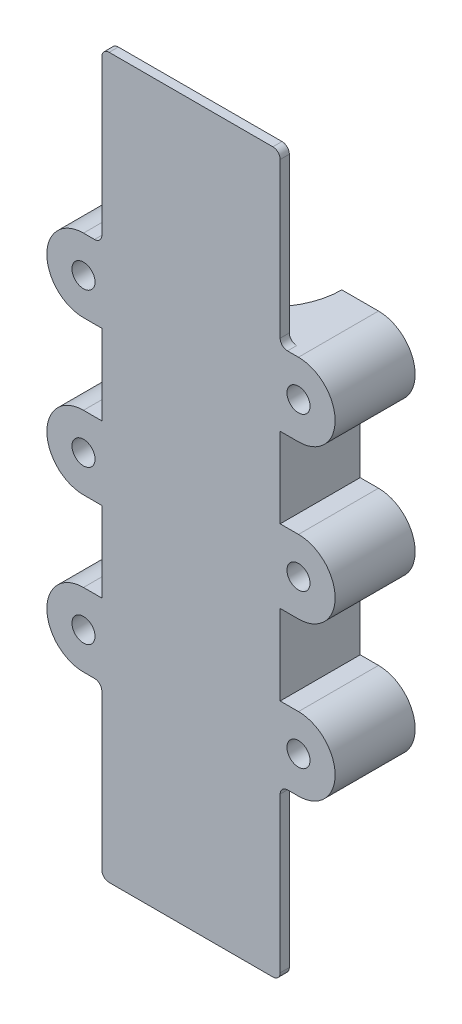
from build123d import *

# Parameters (mm, degrees)
BOSS_EXTRUDE1_DEPTH = 65.8876
BOSS_EXTRUDE2_DEPTH = 29.3624
SKETCH4_R           = 2
BOSS_EXTRUDE3_DEPTH = 13.8684
FILLET1_R           = 1.27


with BuildPart() as part:
    # Sketch1 → Boss-Extrude1 (new body)
    with BuildSketch(Plane(origin=(0, 0, 0), x_dir=(1, 0, 0), z_dir=(0, 1, 0))):
        with BuildLine():
            Line((-12.2809, 0), (-15.4559, 0))
            Line((-15.4559, 0), (-15.4559, -13.3604))
            Line((-15.4559, -13.3604), (-15.4559, -13.8684))
            Line((-15.4559, -13.8684), (0, -13.8684))
            Line((0, -13.8684), (15.4559, -13.8684))
            Line((15.4559, -13.8684), (15.4559, -13.3604))
            Line((15.4559, -13.3604), (15.4559, 0))
            Line((15.4559, 0), (12.2809, 0))
            ThreePointArc((12.2809, 0), (0, -12.2809), (-12.2809, 0))
        make_face()
    extrude(amount=BOSS_EXTRUDE1_DEPTH)

    # Sketch2 → Boss-Extrude2 (add)
    with BuildSketch(Plane(origin=(0, 65.8876, 0), x_dir=(1, 0, 0), z_dir=(0, 1, 0))):
        Polygon((-12.2809, -12.2809), (0, -12.2809), (12.2809, -12.2809), (15.4559, -12.2809), (15.4559, -13.3604), (15.4559, -13.8684), (-15.4559, -13.8684), (-15.4559, -13.3604), (-15.4559, -12.2809), align=None)
    boss_extrude2 = extrude(amount=BOSS_EXTRUDE2_DEPTH)

    # Mirror1: Boss-Extrude2 across plane
    add(boss_extrude2.mirror(Plane.ZX.offset(32.9438)))

    # Sketch4 → Boss-Extrude3 (add, through all)
    # profile 1 of 6: a face of its own
    with BuildSketch(Plane(origin=(0, 0, 0), x_dir=(-1, 0, 0), z_dir=(0, 0, -1))):
        with BuildLine():
            Line((-15.4559, 39.2938), (-15.4559, 26.5938))
            Line((-15.4559, 26.5938), (-18.6309, 26.5938))
            ThreePointArc((-18.6309, 26.5938), (-24.9809, 32.9438), (-18.6309, 39.2938))
            Line((-18.6309, 39.2938), (-15.4559, 39.2938))
        make_face()
        with Locations((-18.6309, 32.9438)):
            Circle(SKETCH4_R, mode=Mode.SUBTRACT)
    # profile 2 of 6: a face of its own
    with BuildSketch(Plane(origin=(0, 0, 0), x_dir=(-1, 0, 0), z_dir=(0, 0, -1))):
        with BuildLine():
            Line((-15.4559, 12.7), (-18.6309, 12.7))
            ThreePointArc((-18.6309, 12.7), (-24.9809, 6.35), (-18.6309, 0))
            Line((-18.6309, 0), (-15.4559, 0))
            Line((-15.4559, 0), (-15.4559, 12.7))
        make_face()
        with Locations(Location((-18.6309, 6.35, 0), (0, 0, 180))):
            Circle(SKETCH4_R, mode=Mode.SUBTRACT)
    # profile 3 of 6: a face of its own
    with BuildSketch(Plane(origin=(0, 0, 0), x_dir=(-1, 0, 0), z_dir=(0, 0, -1))):
        with BuildLine():
            Line((-18.6309, 65.8876), (-15.4559, 65.8876))
            Line((-15.4559, 65.8876), (-15.4559, 53.1876))
            Line((-15.4559, 53.1876), (-18.6309, 53.1876))
            ThreePointArc((-18.6309, 53.1876), (-24.9809, 59.5376), (-18.6309, 65.8876))
        make_face()
        with Locations((-18.6309, 59.5376)):
            Circle(SKETCH4_R, mode=Mode.SUBTRACT)
    # profile 4 of 6: a face of its own
    with BuildSketch(Plane(origin=(0, 0, 0), x_dir=(-1, 0, 0), z_dir=(0, 0, -1))):
        with BuildLine():
            Line((18.6309, 0), (15.4559, 0))
            Line((15.4559, 0), (15.4559, 12.7))
            Line((15.4559, 12.7), (18.6309, 12.7))
            ThreePointArc((18.6309, 12.7), (24.9809, 6.35), (18.6309, 0))
        make_face()
        with Locations((18.6309, 6.35)):
            Circle(SKETCH4_R, mode=Mode.SUBTRACT)
    # profile 5 of 6: a face of its own
    with BuildSketch(Plane(origin=(0, 0, 0), x_dir=(-1, 0, 0), z_dir=(0, 0, -1))):
        with BuildLine():
            Line((15.4559, 53.1876), (18.6309, 53.1876))
            ThreePointArc((18.6309, 53.1876), (24.9809, 59.5376), (18.6309, 65.8876))
            Line((18.6309, 65.8876), (15.4559, 65.8876))
            Line((15.4559, 65.8876), (15.4559, 53.1876))
        make_face()
        with Locations(Location((18.6309, 59.5376, 0), (0, 0, 180))):
            Circle(SKETCH4_R, mode=Mode.SUBTRACT)
    # profile 6 of 6: a face of its own
    with BuildSketch(Plane(origin=(0, 0, 0), x_dir=(-1, 0, 0), z_dir=(0, 0, -1))):
        with BuildLine():
            Line((18.6309, 26.5938), (15.4559, 26.5938))
            Line((15.4559, 26.5938), (15.4559, 39.2938))
            Line((15.4559, 39.2938), (18.6309, 39.2938))
            ThreePointArc((18.6309, 39.2938), (24.9809, 32.9438), (18.6309, 26.5938))
        make_face()
        with Locations(Location((18.6309, 32.9438, 0), (0, 0, 180))):
            Circle(SKETCH4_R, mode=Mode.SUBTRACT)
    extrude(amount=-BOSS_EXTRUDE3_DEPTH)

    # Fillet1
    fillet1_edges = [part.edges().sort_by_distance(p)[0] for p in [
        (-15.4559, 65.8876, 13.07465),
        (-15.4559, 0, 13.07465),
        (15.4559, 95.25, 13.07465),
        (-15.4559, 95.25, 13.07465),
        (-15.4559, -29.3624, 13.07465),
        (15.4559, -29.3624, 13.07465),
        (15.4559, 65.8876, 13.07465),
        (15.4559, 0, 13.07465),
    ]]
    fillet(fillet1_edges, radius=FILLET1_R)


solid = part.part
